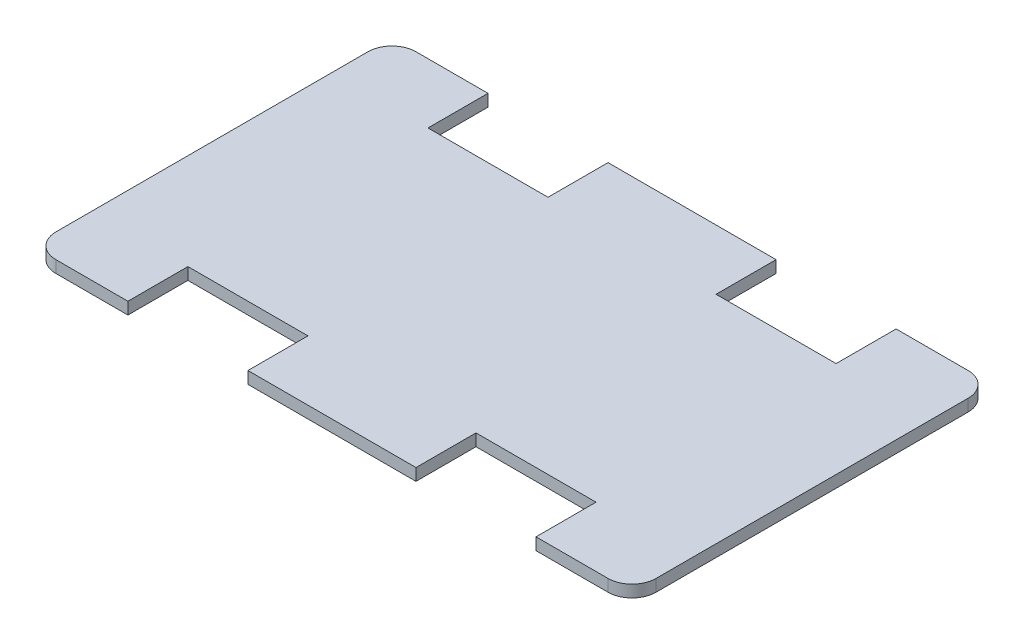
from build123d import *

# Parameters (mm, degrees)
BOSS_EXTRUDE1_DEPTH = 5


with BuildPart() as part:
    # Sketch1 → Boss-Extrude1 (new body)
    with BuildSketch(Plane(origin=(0, 0, 0), x_dir=(1, 0, 0), z_dir=(0, 1, 0))):
        with BuildLine():
            Line((64.270386266, 57.510729614), (94.270386266, 57.510729614))
            ThreePointArc((94.270386266, 57.510729614), (101.341454078, 54.581797426), (104.270386266, 47.510729614))
            Line((104.270386266, 47.510729614), (104.270386266, -82.489270386))
            ThreePointArc((104.270386266, -82.489270386), (101.341454078, -89.560338198), (94.270386266, -92.489270386))
            Line((94.270386266, -92.489270386), (64.270386266, -92.489270386))
            Line((64.270386266, -92.489270386), (64.270386266, -67.489270386))
            Line((64.270386266, -67.489270386), (14.270386266, -67.489270386))
            Line((14.270386266, -67.489270386), (14.270386266, -92.489270386))
            Line((14.270386266, -92.489270386), (-55.729613734, -92.489270386))
            Line((-55.729613734, -92.489270386), (-55.729613734, -67.489270386))
            Line((-55.729613734, -67.489270386), (-105.729613734, -67.489270386))
            Line((-105.729613734, -67.489270386), (-105.729613734, -92.489270386))
            Line((-105.729613734, -92.489270386), (-135.729613734, -92.489270386))
            ThreePointArc((-135.729613734, -92.489270386), (-142.800681546, -89.560338198), (-145.729613734, -82.489270386))
            Line((-145.729613734, -82.489270386), (-145.729613734, 47.510729614))
            ThreePointArc((-145.729613734, 47.510729614), (-142.800681546, 54.581797426), (-135.729613734, 57.510729614))
            Line((-135.729613734, 57.510729614), (-105.729613734, 57.510729614))
            Line((-105.729613734, 57.510729614), (-105.729613734, 32.510729614))
            Line((-105.729613734, 32.510729614), (-55.729613734, 32.510729614))
            Line((-55.729613734, 32.510729614), (-55.729613734, 57.510729614))
            Line((-55.729613734, 57.510729614), (14.270386266, 57.510729614))
            Line((14.270386266, 57.510729614), (14.270386266, 32.510729614))
            Line((14.270386266, 32.510729614), (64.270386266, 32.510729614))
            Line((64.270386266, 32.510729614), (64.270386266, 57.510729614))
        make_face()
    extrude(amount=BOSS_EXTRUDE1_DEPTH)


solid = part.part
